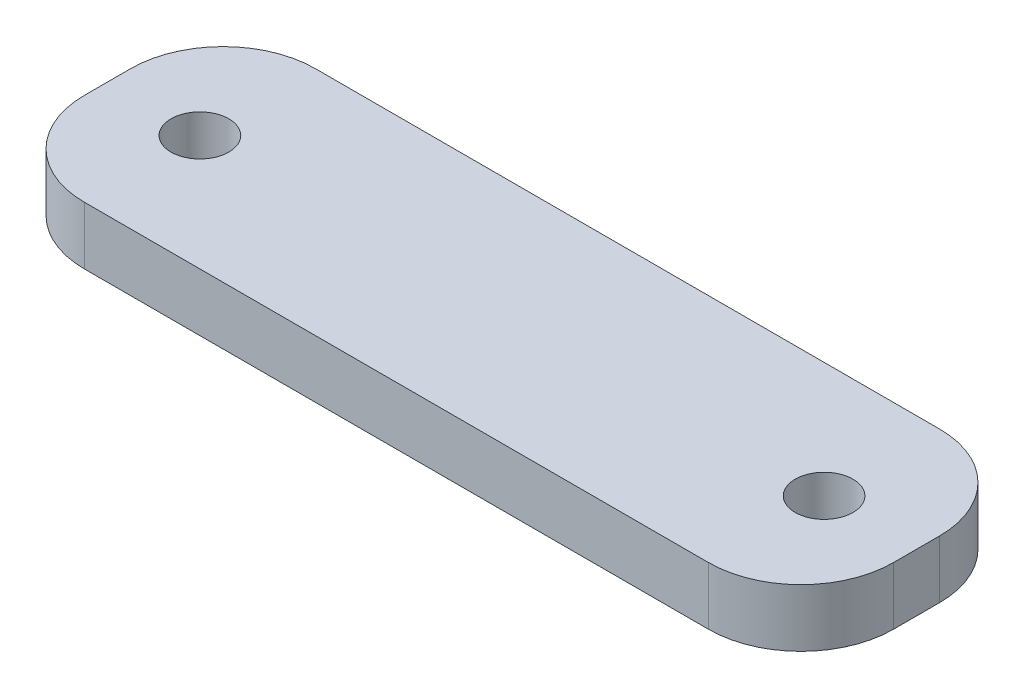
from build123d import *

# Parameters (mm, degrees)
SKETCH1_R           = 2.5
BOSS_EXTRUDE1_DEPTH = 5


with BuildPart() as part:
    # Sketch1 → Boss-Extrude1 (new body)
    with BuildSketch(Plane(origin=(0, 0, 0), x_dir=(1, 0, 0), z_dir=(0, 1, 0))):
        with BuildLine():
            Line((8, 0), (62, 0))
            ThreePointArc((62, 0), (67.656854249, -2.343145751), (70, -8))
            Line((70, -8), (70, -12))
            ThreePointArc((70, -12), (67.656854249, -17.656854249), (62, -20))
            Line((62, -20), (8, -20))
            ThreePointArc((8, -20), (2.343145751, -17.656854249), (0, -12))
            Line((0, -12), (0, -8))
            ThreePointArc((0, -8), (2.343145751, -2.343145751), (8, 0))
        make_face()
        with Locations(Location((8, -10, 0), (0, 0, 270))):
            Circle(SKETCH1_R, mode=Mode.SUBTRACT)
        with Locations(Location((62, -10, 0), (0, 0, 90))):
            Circle(SKETCH1_R, mode=Mode.SUBTRACT)
    extrude(amount=BOSS_EXTRUDE1_DEPTH)


solid = part.part
